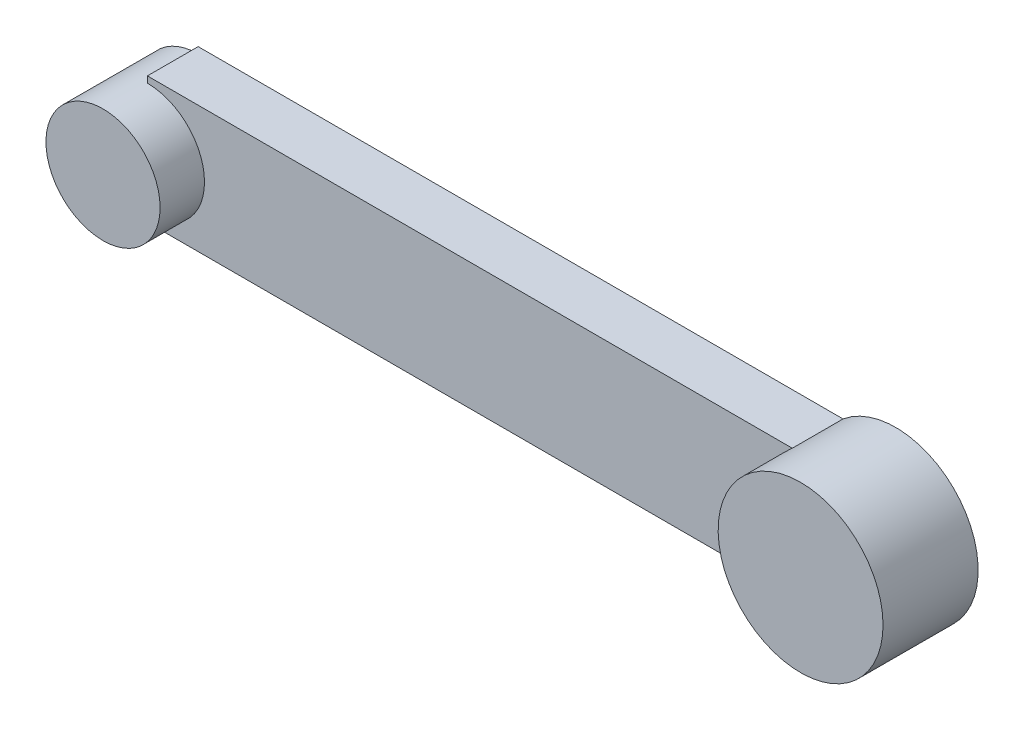
from build123d import *

# Parameters (mm, degrees)
SKETCH_1_W      = 110000
SKETCH_1_H      = 20000
EXTRUDE_1_DEPTH = 8000
SKETCH_2_R      = 9000
EXTRUDE_2_DEPTH = 15000
SKETCH_3_R      = 13000
EXTRUDE_3_DEPTH = 15000


with BuildPart() as part:
    # 草图1 → 凸台-拉伸1 (new body)
    with BuildSketch(Plane.XY):
        with Locations((55000, 115000)):
            Rectangle(SKETCH_1_W, SKETCH_1_H)
    extrude(amount=EXTRUDE_1_DEPTH)

    # 草图2 → 凸台-拉伸2 (add)
    with BuildSketch(Plane.XY):
        with Locations(Location((0, 115000, 0), (0, 0, 270))):
            Circle(SKETCH_2_R)
    extrude(amount=EXTRUDE_2_DEPTH)

    # 草图3 → 凸台-拉伸3 (add)
    with BuildSketch(Plane.XY):
        with Locations(Location((110000, 115000, 0), (0, 0, 230.284862768))):
            Circle(SKETCH_3_R)
    extrude(amount=EXTRUDE_3_DEPTH)


solid = part.part
